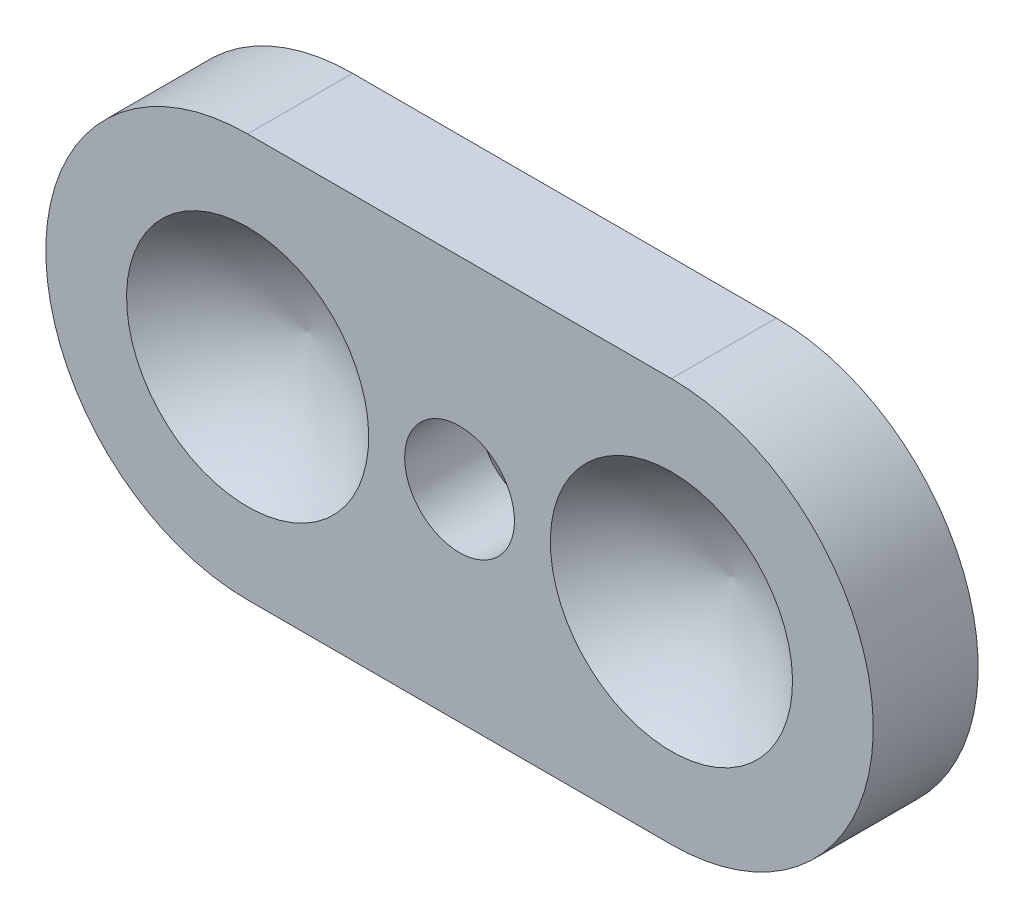
from build123d import *

# Parameters (mm, degrees)
BOSS_EXTRUDE1_DEPTH                               = 3.302
CSK_FOR_4_FLAT_HEAD_MACHINE_SCREW_100_D           = 3.4544
CSK_FOR_4_FLAT_HEAD_MACHINE_SCREW_100_CSINK_D     = 5.715
CSK_FOR_4_FLAT_HEAD_MACHINE_SCREW_100_CSINK_ANGLE = 100


with BuildPart() as part:
    # Sketch1 → Boss-Extrude1 (new body)
    with BuildSketch(Plane.XY):
        with BuildLine():
            Line((-6.6675, 6.35), (6.6675, 6.35))
            ThreePointArc((6.6675, 6.35), (13.0175, 0), (6.6675, -6.35))
            Line((6.6675, -6.35), (-6.6675, -6.35))
            ThreePointArc((-6.6675, -6.35), (-13.0175, 0), (-6.6675, 6.35))
        make_face()
    extrude(amount=BOSS_EXTRUDE1_DEPTH)

    # Sketch4 → Cut-Revolve3 (revolve, cut)
    with BuildSketch(Plane(origin=(6.6675, 0, 0), x_dir=(0, 0, -1), z_dir=(1, 0, 0))):
        with BuildLine():
            Line((-3.302, 3.81), (-3.302, 0))
            Line((-3.302, 0), (-1.397, 0))
            ThreePointArc((-1.397, 0), (-2.038412152, 2.060543924), (-3.302, 3.81))
        make_face()
    cut_revolve3 = revolve(axis=Axis((6.6675, 0, 1.397), (0, 0, 1)), mode=Mode.SUBTRACT)

    # Mirror1: Cut-Revolve3 across plane
    add(cut_revolve3.mirror(Plane(origin=(0, 0, 0), x_dir=(0, 0, 1), z_dir=(1, 0, 0))), mode=Mode.SUBTRACT)

    # CSK for #4 Flat Head Machine Screw (100)1 (through all)
    with Locations(Plane(origin=(0, 0, 0), x_dir=(-1, 0, 0), z_dir=(0, 0, -1))):
        with Locations((0, 0)):
            CounterSinkHole(CSK_FOR_4_FLAT_HEAD_MACHINE_SCREW_100_D / 2, CSK_FOR_4_FLAT_HEAD_MACHINE_SCREW_100_CSINK_D / 2, counter_sink_angle=CSK_FOR_4_FLAT_HEAD_MACHINE_SCREW_100_CSINK_ANGLE)


solid = part.part
